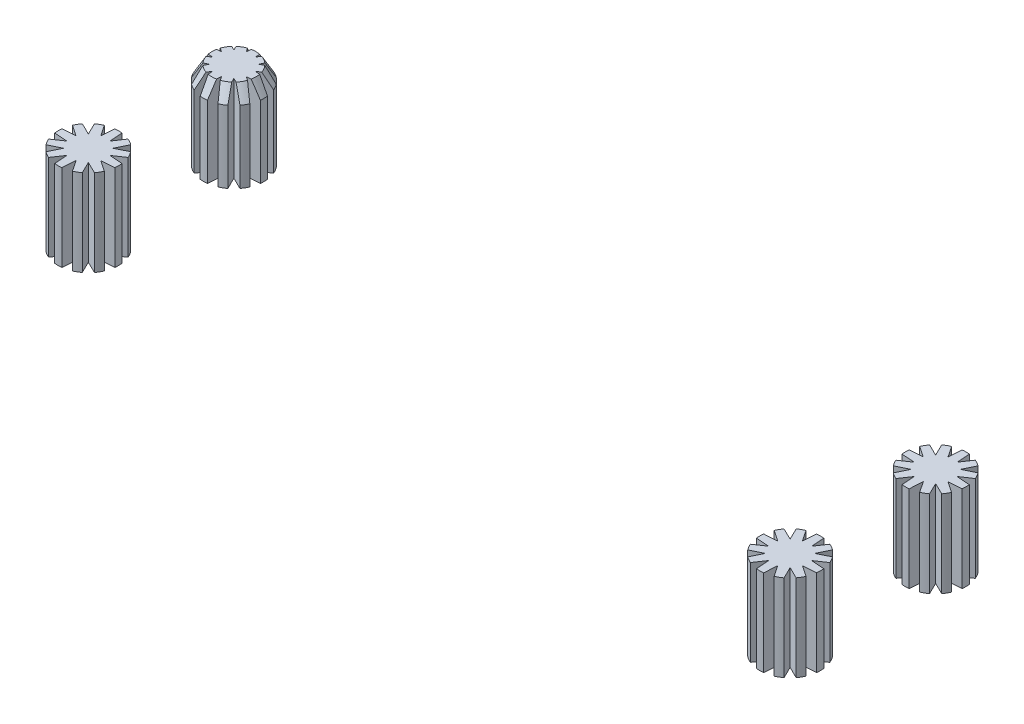
from build123d import *
from OCP.BRepFilletAPI import BRepFilletAPI_MakeChamfer

# Parameters (mm, degrees)
BOSS_EXTRUDE3_DEPTH   = 6
BOSS_EXTRUDE3_2_DEPTH = 6
BOSS_EXTRUDE3_3_DEPTH = 6
BOSS_EXTRUDE3_4_DEPTH = 6
CHAMFER3_SIZE         = 1
CHAMFER3_SIZE2        = 0.577350269


with BuildPart() as part:
    # Sketch4 → Boss-Extrude3 (new body)
    with BuildSketch(Plane(origin=(0, 0, 0), x_dir=(1, 0, 0), z_dir=(0, 1, 0))):
        with BuildLine():
            Line((-24.1, 2.964934054), (-24.036113164, 3.878558379))
            Line((-24.036113164, 3.878558379), (-23.523973378, 3.119279922))
            ThreePointArc((-23.523973378, 3.119279922), (-23.3, 3.231346652), (-23.090960676, 3.369279922))
            Line((-23.090960676, 3.369279922), (-23.492445215, 4.192445215))
            Line((-23.492445215, 4.192445215), (-22.669279922, 3.790960676))
            ThreePointArc((-22.669279922, 3.790960676), (-22.531346652, 4), (-22.419279922, 4.223973378))
            Line((-22.419279922, 4.223973378), (-23.178558379, 4.736113164))
            Line((-23.178558379, 4.736113164), (-22.264934054, 4.8))
            ThreePointArc((-22.264934054, 4.8), (-22.25, 5.05), (-22.264934054, 5.3))
            Line((-22.264934054, 5.3), (-23.178558379, 5.363886836))
            Line((-23.178558379, 5.363886836), (-22.419279922, 5.876026622))
            ThreePointArc((-22.419279922, 5.876026622), (-22.531346652, 6.1), (-22.669279922, 6.309039324))
            Line((-22.669279922, 6.309039324), (-23.492445215, 5.907554785))
            Line((-23.492445215, 5.907554785), (-23.090960676, 6.730720078))
            ThreePointArc((-23.090960676, 6.730720078), (-23.3, 6.868653348), (-23.523973378, 6.980720078))
            Line((-23.523973378, 6.980720078), (-24.036113164, 6.221441621))
            Line((-24.036113164, 6.221441621), (-24.1, 7.135065946))
            ThreePointArc((-24.1, 7.135065946), (-24.35, 7.15), (-24.6, 7.135065946))
            Line((-24.6, 7.135065946), (-24.663886836, 6.221441621))
            Line((-24.663886836, 6.221441621), (-25.176026622, 6.980720078))
            ThreePointArc((-25.176026622, 6.980720078), (-25.4, 6.868653348), (-25.609039324, 6.730720078))
            Line((-25.609039324, 6.730720078), (-25.207554785, 5.907554785))
            Line((-25.207554785, 5.907554785), (-26.030720078, 6.309039324))
            ThreePointArc((-26.030720078, 6.309039324), (-26.168653348, 6.1), (-26.280720078, 5.876026622))
            Line((-26.280720078, 5.876026622), (-25.521441621, 5.363886836))
            Line((-25.521441621, 5.363886836), (-26.435065946, 5.3))
            ThreePointArc((-26.435065946, 5.3), (-26.45, 5.05), (-26.435065946, 4.8))
            Line((-26.435065946, 4.8), (-25.521441621, 4.736113164))
            Line((-25.521441621, 4.736113164), (-26.280720078, 4.223973378))
            ThreePointArc((-26.280720078, 4.223973378), (-26.168653348, 4), (-26.030720078, 3.790960676))
            Line((-26.030720078, 3.790960676), (-25.207554785, 4.192445215))
            Line((-25.207554785, 4.192445215), (-25.609039324, 3.369279922))
            ThreePointArc((-25.609039324, 3.369279922), (-25.4, 3.231346652), (-25.176026622, 3.119279922))
            Line((-25.176026622, 3.119279922), (-24.663886836, 3.878558379))
            Line((-24.663886836, 3.878558379), (-24.6, 2.964934054))
            ThreePointArc((-24.6, 2.964934054), (-24.35, 2.95), (-24.1, 2.964934054))
        make_face()
    extrude(amount=BOSS_EXTRUDE3_DEPTH)

    # Chamfer3: one chamfer whose edges measure the first distance from different faces: ONE call of the kernel's chamfer builder (chamfer() names one face for all edges)
    chamfer3_edges_1 = [part.edges().sort_by_distance(p)[0] for p in [
        (-23.3, 6, -6.868653348),
    ]]
    chamfer3_side_1 = [part.faces().sort_by_distance(p)[0] for p in [
        (-23.3, 3, -6.868653348),
    ]]
    chamfer3_edges_2 = [part.edges().sort_by_distance(p)[0] for p in [
        (-22.531346652, 6, -6.1),
    ]]
    chamfer3_side_2 = [part.faces().sort_by_distance(p)[0] for p in [
        (-22.531346652, 3, -6.1),
    ]]
    chamfer3_edges_3 = [part.edges().sort_by_distance(p)[0] for p in [
        (-25.4, 6, -6.868653348),
    ]]
    chamfer3_side_3 = [part.faces().sort_by_distance(p)[0] for p in [
        (-25.4, 3, -6.868653348),
    ]]
    chamfer3_edges_4 = [part.edges().sort_by_distance(p)[0] for p in [
        (-24.35, 6, -7.15),
    ]]
    chamfer3_side_4 = [part.faces().sort_by_distance(p)[0] for p in [
        (-24.35, 3, -7.15),
    ]]
    chamfer3_edges_5 = [part.edges().sort_by_distance(p)[0] for p in [
        (-23.3, 6, -3.231346652),
    ]]
    chamfer3_side_5 = [part.faces().sort_by_distance(p)[0] for p in [
        (-23.3, 3, -3.231346652),
    ]]
    chamfer3_edges_6 = [part.edges().sort_by_distance(p)[0] for p in [
        (-24.35, 6, -2.95),
    ]]
    chamfer3_side_6 = [part.faces().sort_by_distance(p)[0] for p in [
        (-24.35, 3, -2.95),
    ]]
    chamfer3_edges_7 = [part.edges().sort_by_distance(p)[0] for p in [
        (-22.25, 6, -5.05),
    ]]
    chamfer3_side_7 = [part.faces().sort_by_distance(p)[0] for p in [
        (-22.25, 3, -5.05),
    ]]
    chamfer3_edges_8 = [part.edges().sort_by_distance(p)[0] for p in [
        (-22.531346652, 6, -4),
    ]]
    chamfer3_side_8 = [part.faces().sort_by_distance(p)[0] for p in [
        (-22.531346652, 3, -4),
    ]]
    chamfer3_edges_9 = [part.edges().sort_by_distance(p)[0] for p in [
        (-26.45, 6, -5.05),
    ]]
    chamfer3_side_9 = [part.faces().sort_by_distance(p)[0] for p in [
        (-26.45, 3, -5.05),
    ]]
    chamfer3_edges_10 = [part.edges().sort_by_distance(p)[0] for p in [
        (-26.168653348, 6, -6.1),
    ]]
    chamfer3_side_10 = [part.faces().sort_by_distance(p)[0] for p in [
        (-26.168653348, 3, -6.1),
    ]]
    chamfer3_edges_11 = [part.edges().sort_by_distance(p)[0] for p in [
        (-25.4, 6, -3.231346652),
    ]]
    chamfer3_side_11 = [part.faces().sort_by_distance(p)[0] for p in [
        (-25.4, 3, -3.231346652),
    ]]
    chamfer3_edges_12 = [part.edges().sort_by_distance(p)[0] for p in [
        (-26.168653348, 6, -4),
    ]]
    chamfer3_side_12 = [part.faces().sort_by_distance(p)[0] for p in [
        (-26.168653348, 3, -4),
    ]]
    chamfer3 = BRepFilletAPI_MakeChamfer(part.part.solid().wrapped)
    for e in chamfer3_edges_1:
        chamfer3.Add(CHAMFER3_SIZE, CHAMFER3_SIZE2, e.wrapped, chamfer3_side_1[0].wrapped)  # the first distance lies on this face
    for e in chamfer3_edges_2:
        chamfer3.Add(CHAMFER3_SIZE, CHAMFER3_SIZE2, e.wrapped, chamfer3_side_2[0].wrapped)  # the first distance lies on this face
    for e in chamfer3_edges_3:
        chamfer3.Add(CHAMFER3_SIZE, CHAMFER3_SIZE2, e.wrapped, chamfer3_side_3[0].wrapped)  # the first distance lies on this face
    for e in chamfer3_edges_4:
        chamfer3.Add(CHAMFER3_SIZE, CHAMFER3_SIZE2, e.wrapped, chamfer3_side_4[0].wrapped)  # the first distance lies on this face
    for e in chamfer3_edges_5:
        chamfer3.Add(CHAMFER3_SIZE, CHAMFER3_SIZE2, e.wrapped, chamfer3_side_5[0].wrapped)  # the first distance lies on this face
    for e in chamfer3_edges_6:
        chamfer3.Add(CHAMFER3_SIZE, CHAMFER3_SIZE2, e.wrapped, chamfer3_side_6[0].wrapped)  # the first distance lies on this face
    for e in chamfer3_edges_7:
        chamfer3.Add(CHAMFER3_SIZE, CHAMFER3_SIZE2, e.wrapped, chamfer3_side_7[0].wrapped)  # the first distance lies on this face
    for e in chamfer3_edges_8:
        chamfer3.Add(CHAMFER3_SIZE, CHAMFER3_SIZE2, e.wrapped, chamfer3_side_8[0].wrapped)  # the first distance lies on this face
    for e in chamfer3_edges_9:
        chamfer3.Add(CHAMFER3_SIZE, CHAMFER3_SIZE2, e.wrapped, chamfer3_side_9[0].wrapped)  # the first distance lies on this face
    for e in chamfer3_edges_10:
        chamfer3.Add(CHAMFER3_SIZE, CHAMFER3_SIZE2, e.wrapped, chamfer3_side_10[0].wrapped)  # the first distance lies on this face
    for e in chamfer3_edges_11:
        chamfer3.Add(CHAMFER3_SIZE, CHAMFER3_SIZE2, e.wrapped, chamfer3_side_11[0].wrapped)  # the first distance lies on this face
    for e in chamfer3_edges_12:
        chamfer3.Add(CHAMFER3_SIZE, CHAMFER3_SIZE2, e.wrapped, chamfer3_side_12[0].wrapped)  # the first distance lies on this face
    add(Compound.cast(chamfer3.Shape()), mode=Mode.REPLACE)


with BuildPart() as body_2:
    # Sketch4 → Boss-Extrude3 2 (new body)
    with BuildSketch(Plane(origin=(0, 0, 0), x_dir=(1, 0, 0), z_dir=(0, 1, 0))):
        with BuildLine():
            Line((-22.669279922, -3.790960676), (-23.492445215, -4.192445215))
            Line((-23.492445215, -4.192445215), (-23.090960676, -3.369279922))
            ThreePointArc((-23.090960676, -3.369279922), (-23.3, -3.231346652), (-23.523973378, -3.119279922))
            Line((-23.523973378, -3.119279922), (-24.036113164, -3.878558379))
            Line((-24.036113164, -3.878558379), (-24.1, -2.964934054))
            ThreePointArc((-24.1, -2.964934054), (-24.35, -2.95), (-24.6, -2.964934054))
            Line((-24.6, -2.964934054), (-24.663886836, -3.878558379))
            Line((-24.663886836, -3.878558379), (-25.176026622, -3.119279922))
            ThreePointArc((-25.176026622, -3.119279922), (-25.4, -3.231346652), (-25.609039324, -3.369279922))
            Line((-25.609039324, -3.369279922), (-25.207554785, -4.192445215))
            Line((-25.207554785, -4.192445215), (-26.030720078, -3.790960676))
            ThreePointArc((-26.030720078, -3.790960676), (-26.168653348, -4), (-26.280720078, -4.223973378))
            Line((-26.280720078, -4.223973378), (-25.521441621, -4.736113164))
            Line((-25.521441621, -4.736113164), (-26.435065946, -4.8))
            ThreePointArc((-26.435065946, -4.8), (-26.45, -5.05), (-26.435065946, -5.3))
            Line((-26.435065946, -5.3), (-25.521441621, -5.363886836))
            Line((-25.521441621, -5.363886836), (-26.280720078, -5.876026622))
            ThreePointArc((-26.280720078, -5.876026622), (-26.168653348, -6.1), (-26.030720078, -6.309039324))
            Line((-26.030720078, -6.309039324), (-25.207554785, -5.907554785))
            Line((-25.207554785, -5.907554785), (-25.609039324, -6.730720078))
            ThreePointArc((-25.609039324, -6.730720078), (-25.4, -6.868653348), (-25.176026622, -6.980720078))
            Line((-25.176026622, -6.980720078), (-24.663886836, -6.221441621))
            Line((-24.663886836, -6.221441621), (-24.6, -7.135065946))
            ThreePointArc((-24.6, -7.135065946), (-24.35, -7.15), (-24.1, -7.135065946))
            Line((-24.1, -7.135065946), (-24.036113164, -6.221441621))
            Line((-24.036113164, -6.221441621), (-23.523973378, -6.980720078))
            ThreePointArc((-23.523973378, -6.980720078), (-23.3, -6.868653348), (-23.090960676, -6.730720078))
            Line((-23.090960676, -6.730720078), (-23.492445215, -5.907554785))
            Line((-23.492445215, -5.907554785), (-22.669279922, -6.309039324))
            ThreePointArc((-22.669279922, -6.309039324), (-22.531346652, -6.1), (-22.419279922, -5.876026622))
            Line((-22.419279922, -5.876026622), (-23.178558379, -5.363886836))
            Line((-23.178558379, -5.363886836), (-22.264934054, -5.3))
            ThreePointArc((-22.264934054, -5.3), (-22.25, -5.05), (-22.264934054, -4.8))
            Line((-22.264934054, -4.8), (-23.178558379, -4.736113164))
            Line((-23.178558379, -4.736113164), (-22.419279922, -4.223973378))
            ThreePointArc((-22.419279922, -4.223973378), (-22.531346652, -4), (-22.669279922, -3.790960676))
        make_face()
    extrude(amount=BOSS_EXTRUDE3_2_DEPTH)


with BuildPart() as body_3:
    # Sketch4 → Boss-Extrude3 3 (new body)
    with BuildSketch(Plane(origin=(0, 0, 0), x_dir=(1, 0, 0), z_dir=(0, 1, 0))):
        with BuildLine():
            Line((24.1, -2.964934054), (24.036113164, -3.878558379))
            Line((24.036113164, -3.878558379), (23.523973378, -3.119279922))
            ThreePointArc((23.523973378, -3.119279922), (23.3, -3.231346652), (23.090960676, -3.369279922))
            Line((23.090960676, -3.369279922), (23.492445215, -4.192445215))
            Line((23.492445215, -4.192445215), (22.669279922, -3.790960676))
            ThreePointArc((22.669279922, -3.790960676), (22.531346652, -4), (22.419279922, -4.223973378))
            Line((22.419279922, -4.223973378), (23.178558379, -4.736113164))
            Line((23.178558379, -4.736113164), (22.264934054, -4.8))
            ThreePointArc((22.264934054, -4.8), (22.25, -5.05), (22.264934054, -5.3))
            Line((22.264934054, -5.3), (23.178558379, -5.363886836))
            Line((23.178558379, -5.363886836), (22.419279922, -5.876026622))
            ThreePointArc((22.419279922, -5.876026622), (22.531346652, -6.1), (22.669279922, -6.309039324))
            Line((22.669279922, -6.309039324), (23.492445215, -5.907554785))
            Line((23.492445215, -5.907554785), (23.090960676, -6.730720078))
            ThreePointArc((23.090960676, -6.730720078), (23.3, -6.868653348), (23.523973378, -6.980720078))
            Line((23.523973378, -6.980720078), (24.036113164, -6.221441621))
            Line((24.036113164, -6.221441621), (24.1, -7.135065946))
            ThreePointArc((24.1, -7.135065946), (24.35, -7.15), (24.6, -7.135065946))
            Line((24.6, -7.135065946), (24.663886836, -6.221441621))
            Line((24.663886836, -6.221441621), (25.176026622, -6.980720078))
            ThreePointArc((25.176026622, -6.980720078), (25.4, -6.868653348), (25.609039324, -6.730720078))
            Line((25.609039324, -6.730720078), (25.207554785, -5.907554785))
            Line((25.207554785, -5.907554785), (26.030720078, -6.309039324))
            ThreePointArc((26.030720078, -6.309039324), (26.168653348, -6.1), (26.280720078, -5.876026622))
            Line((26.280720078, -5.876026622), (25.521441621, -5.363886836))
            Line((25.521441621, -5.363886836), (26.435065946, -5.3))
            ThreePointArc((26.435065946, -5.3), (26.45, -5.05), (26.435065946, -4.8))
            Line((26.435065946, -4.8), (25.521441621, -4.736113164))
            Line((25.521441621, -4.736113164), (26.280720078, -4.223973378))
            ThreePointArc((26.280720078, -4.223973378), (26.168653348, -4), (26.030720078, -3.790960676))
            Line((26.030720078, -3.790960676), (25.207554785, -4.192445215))
            Line((25.207554785, -4.192445215), (25.609039324, -3.369279922))
            ThreePointArc((25.609039324, -3.369279922), (25.4, -3.231346652), (25.176026622, -3.119279922))
            Line((25.176026622, -3.119279922), (24.663886836, -3.878558379))
            Line((24.663886836, -3.878558379), (24.6, -2.964934054))
            ThreePointArc((24.6, -2.964934054), (24.35, -2.95), (24.1, -2.964934054))
        make_face()
    extrude(amount=BOSS_EXTRUDE3_3_DEPTH)


with BuildPart() as body_4:
    # Sketch4 → Boss-Extrude3 4 (new body)
    with BuildSketch(Plane(origin=(0, 0, 0), x_dir=(1, 0, 0), z_dir=(0, 1, 0))):
        with BuildLine():
            Line((22.669279922, 3.790960676), (23.492445215, 4.192445215))
            Line((23.492445215, 4.192445215), (23.090960676, 3.369279922))
            ThreePointArc((23.090960676, 3.369279922), (23.3, 3.231346652), (23.523973378, 3.119279922))
            Line((23.523973378, 3.119279922), (24.036113164, 3.878558379))
            Line((24.036113164, 3.878558379), (24.1, 2.964934054))
            ThreePointArc((24.1, 2.964934054), (24.35, 2.95), (24.6, 2.964934054))
            Line((24.6, 2.964934054), (24.663886836, 3.878558379))
            Line((24.663886836, 3.878558379), (25.176026622, 3.119279922))
            ThreePointArc((25.176026622, 3.119279922), (25.4, 3.231346652), (25.609039324, 3.369279922))
            Line((25.609039324, 3.369279922), (25.207554785, 4.192445215))
            Line((25.207554785, 4.192445215), (26.030720078, 3.790960676))
            ThreePointArc((26.030720078, 3.790960676), (26.168653348, 4), (26.280720078, 4.223973378))
            Line((26.280720078, 4.223973378), (25.521441621, 4.736113164))
            Line((25.521441621, 4.736113164), (26.435065946, 4.8))
            ThreePointArc((26.435065946, 4.8), (26.45, 5.05), (26.435065946, 5.3))
            Line((26.435065946, 5.3), (25.521441621, 5.363886836))
            Line((25.521441621, 5.363886836), (26.280720078, 5.876026622))
            ThreePointArc((26.280720078, 5.876026622), (26.168653348, 6.1), (26.030720078, 6.309039324))
            Line((26.030720078, 6.309039324), (25.207554785, 5.907554785))
            Line((25.207554785, 5.907554785), (25.609039324, 6.730720078))
            ThreePointArc((25.609039324, 6.730720078), (25.4, 6.868653348), (25.176026622, 6.980720078))
            Line((25.176026622, 6.980720078), (24.663886836, 6.221441621))
            Line((24.663886836, 6.221441621), (24.6, 7.135065946))
            ThreePointArc((24.6, 7.135065946), (24.35, 7.15), (24.1, 7.135065946))
            Line((24.1, 7.135065946), (24.036113164, 6.221441621))
            Line((24.036113164, 6.221441621), (23.523973378, 6.980720078))
            ThreePointArc((23.523973378, 6.980720078), (23.3, 6.868653348), (23.090960676, 6.730720078))
            Line((23.090960676, 6.730720078), (23.492445215, 5.907554785))
            Line((23.492445215, 5.907554785), (22.669279922, 6.309039324))
            ThreePointArc((22.669279922, 6.309039324), (22.531346652, 6.1), (22.419279922, 5.876026622))
            Line((22.419279922, 5.876026622), (23.178558379, 5.363886836))
            Line((23.178558379, 5.363886836), (22.264934054, 5.3))
            ThreePointArc((22.264934054, 5.3), (22.25, 5.05), (22.264934054, 4.8))
            Line((22.264934054, 4.8), (23.178558379, 4.736113164))
            Line((23.178558379, 4.736113164), (22.419279922, 4.223973378))
            ThreePointArc((22.419279922, 4.223973378), (22.531346652, 4), (22.669279922, 3.790960676))
        make_face()
    extrude(amount=BOSS_EXTRUDE3_4_DEPTH)


solid = Compound([part.part, body_2.part, body_3.part, body_4.part])
